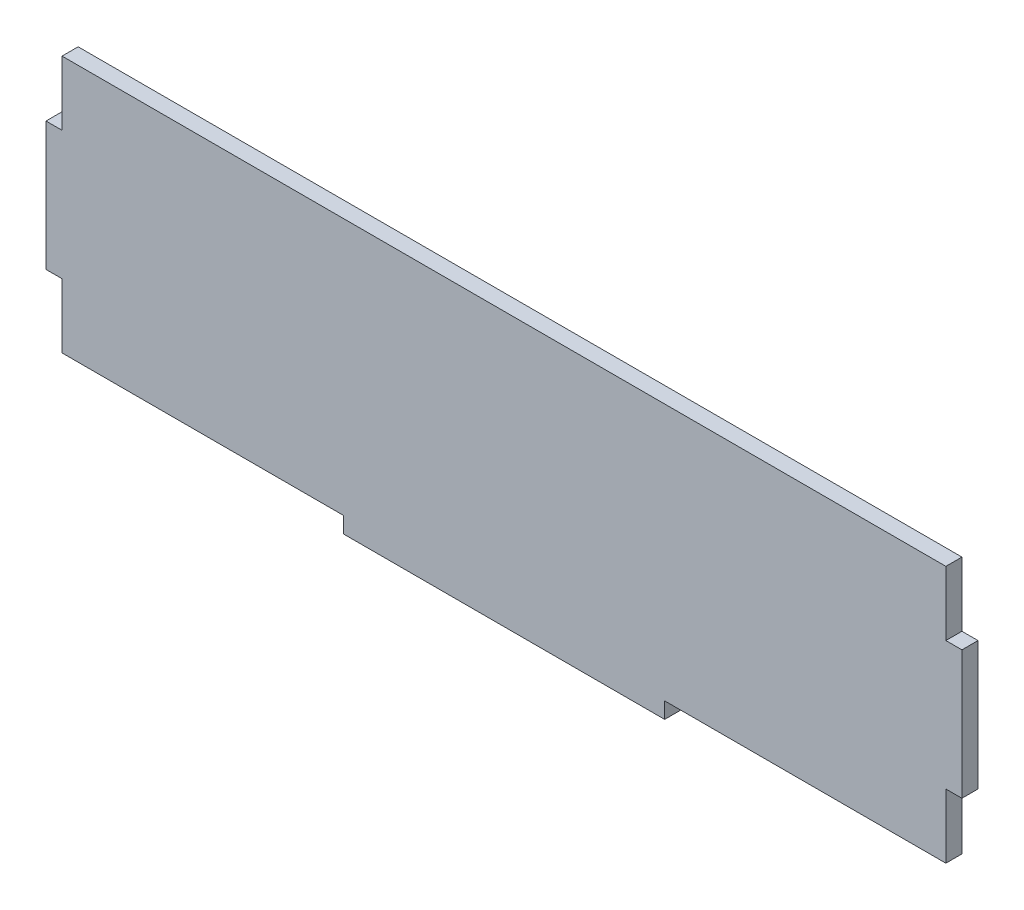
from build123d import *

# Parameters (mm, degrees)
SKIZZE1_W                       = 275
SKIZZE1_H                       = 80
AUFSATZ_LINEAR_AUSTRAGEN1_DEPTH = 5
SKIZZE2_W                       = 100
SKIZZE2_H                       = 5
AUFSATZ_LINEAR_AUSTRAGEN2_DEPTH = 5
SKIZZE3_W                       = 5
SKIZZE3_H                       = 40
AUFSATZ_LINEAR_AUSTRAGEN3_DEPTH = 5


with BuildPart() as part:
    # Skizze1 → Aufsatz-Linear austragen1 (new body)
    with BuildSketch(Plane.XY):
        with Locations((137.5, 40)):
            Rectangle(SKIZZE1_W, SKIZZE1_H)
    extrude(amount=AUFSATZ_LINEAR_AUSTRAGEN1_DEPTH)

    # Skizze2 → Aufsatz-Linear austragen2 (add, through all)
    with BuildSketch(Plane.XY.offset(5)):
        with Locations((137.5, -2.5)):
            Rectangle(SKIZZE2_W, SKIZZE2_H)
    extrude(amount=-AUFSATZ_LINEAR_AUSTRAGEN2_DEPTH)

    # Skizze3 → Aufsatz-Linear austragen3 (add, through all)
    with BuildSketch(Plane.XY.offset(5)):
        with Locations((-2.5, 40)):
            Rectangle(SKIZZE3_W, SKIZZE3_H)
        with Locations((277.5, 40)):
            Rectangle(SKIZZE3_W, SKIZZE3_H)
    extrude(amount=-AUFSATZ_LINEAR_AUSTRAGEN3_DEPTH)


solid = part.part
